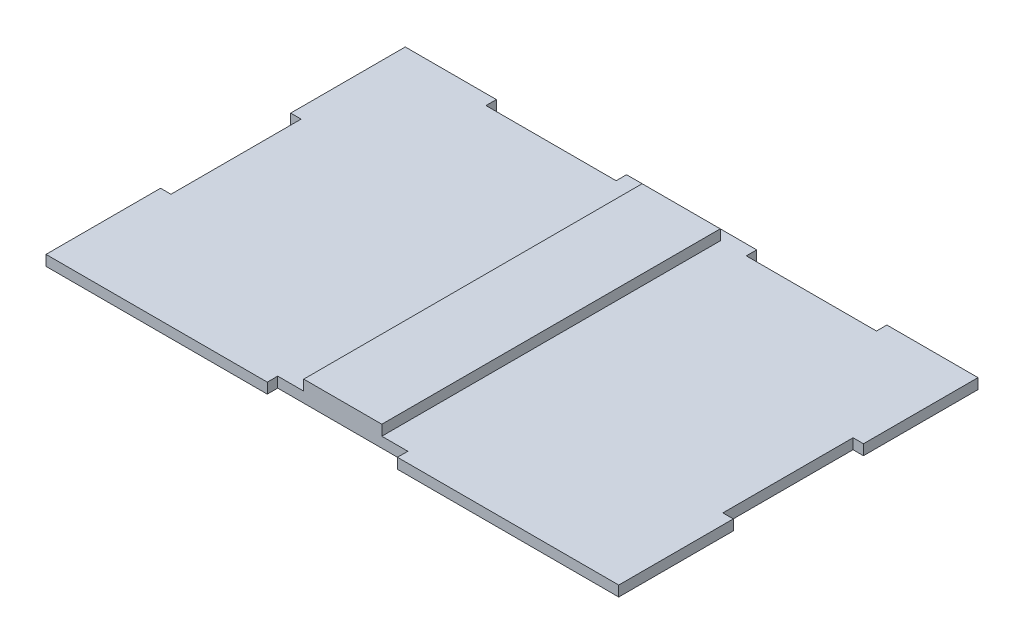
from build123d import *

# Parameters (mm, degrees)
BOSS_EXTRUDE1_DEPTH = 4
SKETCH3_W           = 30
SKETCH3_H           = 130
BOSS_EXTRUDE2_DEPTH = 4


with BuildPart() as part:
    # Sketch2 → Boss-Extrude1 (new body)
    with BuildSketch(Plane(origin=(0, 0, 0), x_dir=(1, 0, 0), z_dir=(0, 1, 0))):
        Polygon((-110, 69), (-110, 25), (-106, 25), (-106, -25), (-110, -25), (-110, -69), (-25, -69), (-25, -65), (25, -65), (25, -69), (110, -69), (110, -25), (106, -25), (106, 25), (110, 25), (110, 69), (75, 69), (75, 65), (25, 65), (25, 69), (-25, 69), (-25, 65), (-75, 65), (-75, 69), align=None)
    extrude(amount=BOSS_EXTRUDE1_DEPTH)

    # Sketch3 → Boss-Extrude2 (add)
    with BuildSketch(Plane(origin=(0, 4, 0), x_dir=(1, 0, 0), z_dir=(0, 1, 0))):
        Rectangle(SKETCH3_W, SKETCH3_H)
    extrude(amount=BOSS_EXTRUDE2_DEPTH)


solid = part.part
